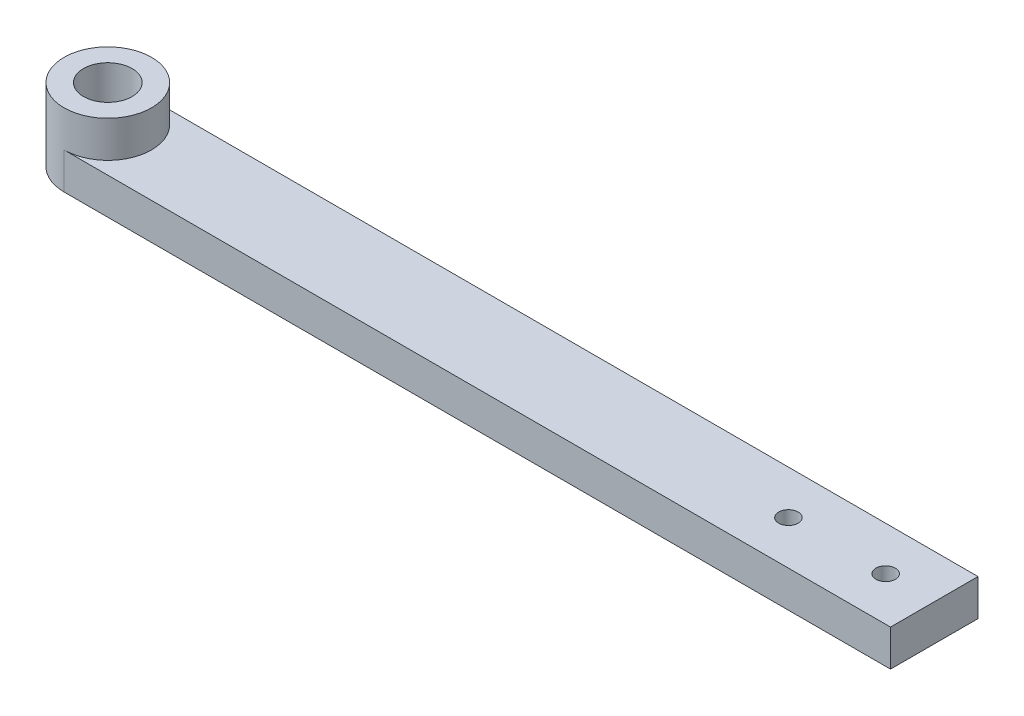
from build123d import *

# Parameters (mm, degrees)
BOSS_EXTRUDE1_DEPTH = 7.5
SKETCH2_R           = 5
SKETCH2_R_2         = 2
CUT_EXTRUDE1_DEPTH  = 171.403198327
SKETCH3_R           = 9
BOSS_EXTRUDE2_DEPTH = 7.5
SKETCH4_R           = 5
CUT_EXTRUDE2_DEPTH  = 171.403198327


with BuildPart() as part:
    # Sketch1 → Boss-Extrude1 (new body)
    with BuildSketch(Plane(origin=(0, 0, 0), x_dir=(1, 0, 0), z_dir=(0, 1, 0))):
        with BuildLine():
            Line((0, 9), (170, 9))
            Line((170, 9), (170, -9))
            Line((170, -9), (0, -9))
            ThreePointArc((0, -9), (-9, 0), (0, 9))
        make_face()
    extrude(amount=BOSS_EXTRUDE1_DEPTH)

    # Sketch2 → Cut-Extrude1 (cut, through all)
    with BuildSketch(Plane(origin=(0, 7.5, 0), x_dir=(1, 0, 0), z_dir=(0, 1, 0))):
        with Locations(Location((0, 0, 0), (0, 0, 270))):
            Circle(SKETCH2_R)
        with Locations(Location((160, 0, 0), (0, 0, 270))):
            Circle(SKETCH2_R_2)
        with Locations(Location((140, 0, 0), (0, 0, 270))):
            Circle(SKETCH2_R_2)
    extrude(amount=-CUT_EXTRUDE1_DEPTH, mode=Mode.SUBTRACT)

    # Sketch3 → Boss-Extrude2 (add)
    with BuildSketch(Plane(origin=(0, 7.5, 0), x_dir=(1, 0, 0), z_dir=(0, 1, 0))):
        with Locations(Location((0, 0, 0), (0, 0, 270))):
            Circle(SKETCH3_R)
    extrude(amount=BOSS_EXTRUDE2_DEPTH)

    # Sketch4 → Cut-Extrude2 (cut, through all)
    with BuildSketch(Plane.XZ.offset(-7.5)):
        with Locations(Location((0, 0, 0), (0, 0, 90))):
            Circle(SKETCH4_R)
    extrude(amount=-CUT_EXTRUDE2_DEPTH, mode=Mode.SUBTRACT)


solid = part.part
